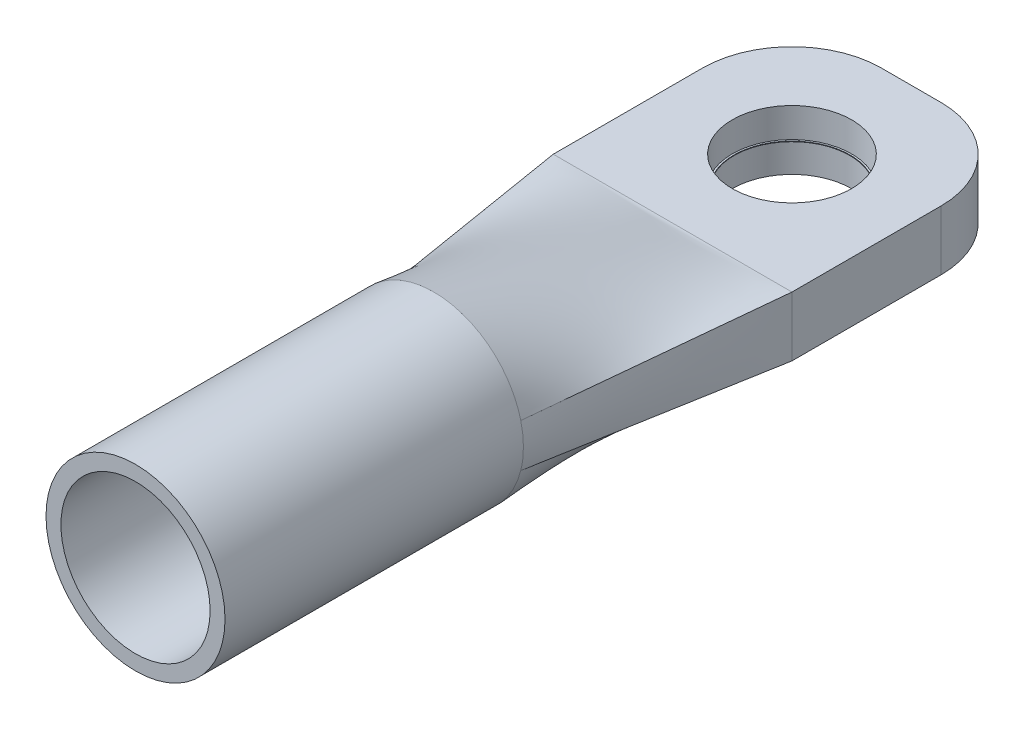
from build123d import *

# Parameters (mm, degrees)
ESQUISSE1_R             = 3
ESQUISSE1_R_2           = 2.5
BOSS_EXTRU_1_DEPTH      = 10
ESQUISSE4_W             = 8
ESQUISSE4_H             = 2
BOSS_EXTRU_2_DEPTH      = 8
CONG_1_R                = 3
ESQUISSE6_R             = 2
ENL_V_MAT_EXTRU_2_DEPTH = 12
BOSS_EXTRU_3_DEPTH      = 0.01
BOSS_EXTRU_3_DEPTH_BACK = 0.01
ESQUISSE7_R             = 2
ESQUISSE7_R_2           = 1.94261234


with BuildPart() as part:
    # Esquisse1 → Boss.-Extru.1 (new body)
    with BuildSketch(Plane.XY):
        Circle(ESQUISSE1_R)
        Circle(ESQUISSE1_R_2, mode=Mode.SUBTRACT)
    extrude(amount=BOSS_EXTRU_1_DEPTH)

    # Esquisse3 for Lissage3 → Lissage3 section 0
    with BuildSketch(Plane(origin=(0, 0, 0), x_dir=(-1, 0, 0), z_dir=(0, 0, -1))):
        with BuildLine():
            # circular arc as an exact rational Bezier (weights 1, cos(half-angle), 1)
            Bezier((-2.9104275, 0.727606875), (0, 12.369316884), (2.9104275, 0.727606875), weights=[1, 0.242535625, 1])
            Bezier((2.9104275, 0.727606875), (3.09232922, 0), (2.9104275, -0.727606875), weights=[1, 0.9701425, 1])
            Bezier((2.9104275, -0.727606875), (0, -12.369316884), (-2.9104275, -0.727606875), weights=[1, 0.242535625, 1])
            Bezier((-2.9104275, -0.727606875), (-3.09232922, 0), (-2.9104275, 0.727606875), weights=[1, 0.9701425, 1])
        make_face()
    # Esquisse2 → Lissage3 section 1
    with BuildSketch(Plane.XY.offset(-8)):
        with BuildLine():
            Line((4, 1), (-4, 1))
            Line((-4, 1), (-4, -1))
            Line((-4, -1), (4, -1))
            Line((4, -1), (4, 1))
        make_face()
    loft()

    # Esquisse4 → Boss.-Extru.2 (add)
    with BuildSketch(Plane(origin=(0, 0, -8), x_dir=(-1, 0, 0), z_dir=(0, 0, -1))):
        Rectangle(ESQUISSE4_W, ESQUISSE4_H)
    extrude(amount=BOSS_EXTRU_2_DEPTH)

    # Congé1
    cong_1_edges = [part.edges().sort_by_distance(p)[0] for p in [
        (-4, 0, -16),
        (4, 0, -16),
    ]]
    fillet(cong_1_edges, radius=CONG_1_R)

    # Esquisse6 → Enlèv. mat.-Extru.2 (cut)
    with BuildSketch(Plane(origin=(0, 1, 0), x_dir=(1, 0, 0), z_dir=(0, 1, 0))):
        with Locations(Location((0, 12, 0), (0, 0, 180))):
            Circle(ESQUISSE6_R)
    extrude(amount=-ENL_V_MAT_EXTRU_2_DEPTH, mode=Mode.SUBTRACT)

    # Esquisse7 → Boss.-Extru.3 (add, two sides: drawn at the far end of the back side and taken through both)
    with BuildSketch(Plane(origin=(0, 0, 0), x_dir=(1, 0, 0), z_dir=(0, 1, 0)).offset(-BOSS_EXTRU_3_DEPTH_BACK)):
        with Locations(Location((0, 12, 0), (0, 0, 180))):
            Circle(ESQUISSE7_R)
        with Locations(Location((0, 12, 0), (0, 0, 270))):
            Circle(ESQUISSE7_R_2, mode=Mode.SUBTRACT)
    extrude(amount=BOSS_EXTRU_3_DEPTH + BOSS_EXTRU_3_DEPTH_BACK)


solid = part.part
